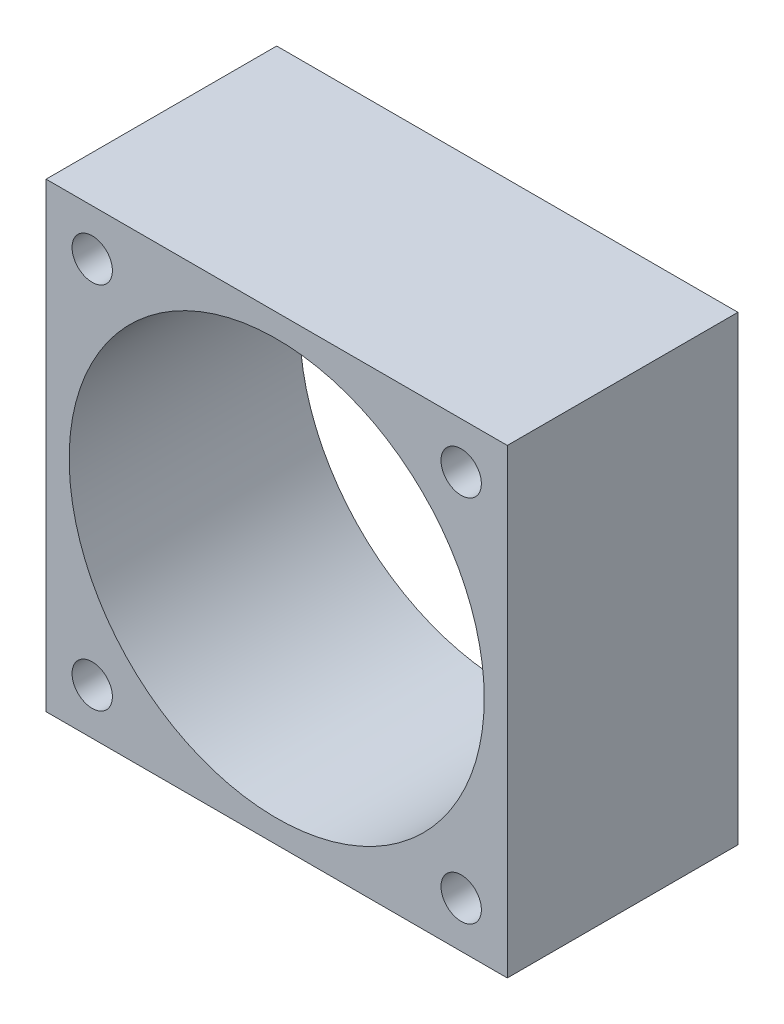
from build123d import *

# Parameters (mm, degrees)
SKETCH_1_W                           = 40
SKETCH_1_H                           = 40
SKETCH_1_R                           = 18
SKETCH_1_R_2                         = 1.75
OFFICIAL_40X40X20_D3P5_PITCH32_DEPTH = 20


with BuildPart() as part:
    # 草图1 → OFFICIAL_40x40x20_D3p5_pitch32 (new body)
    with BuildSketch(Plane.XY):
        with Locations((-10, 53)):
            Rectangle(SKETCH_1_W, SKETCH_1_H)
        with Locations((-10, 53)):
            Circle(SKETCH_1_R, mode=Mode.SUBTRACT)
        with Locations((-26, 37)):
            Circle(SKETCH_1_R_2, mode=Mode.SUBTRACT)
        with Locations((-26, 69)):
            Circle(SKETCH_1_R_2, mode=Mode.SUBTRACT)
        with Locations((6, 37)):
            Circle(SKETCH_1_R_2, mode=Mode.SUBTRACT)
        with Locations((6, 69)):
            Circle(SKETCH_1_R_2, mode=Mode.SUBTRACT)
    extrude(amount=OFFICIAL_40X40X20_D3P5_PITCH32_DEPTH)


solid = part.part
